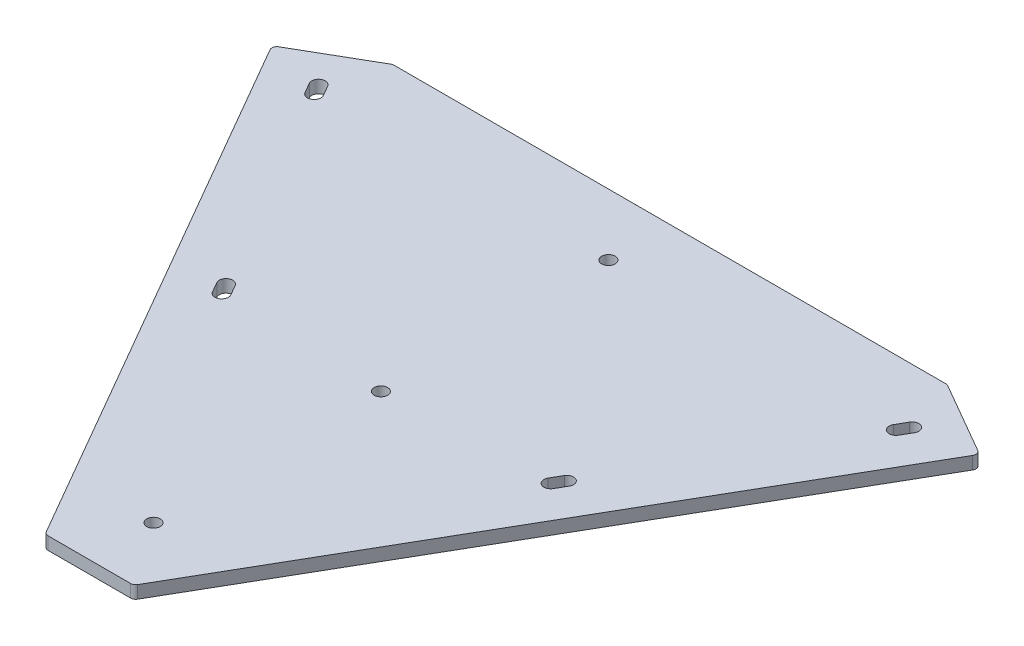
from build123d import *

# Parameters (mm, degrees)
BOSS_EXTRUDE1_DEPTH     = 6.35
F_1_4_CLEARANCE_HOLE1_D = 6.7564
CUT_EXTRUDE1_DEPTH      = 376.065853402
FILLET1_R               = 2.54


with BuildPart() as part:
    # Sketch1 → Boss-Extrude1 (new body)
    with BuildSketch(Plane(origin=(0, 0, 0), x_dir=(1, 0, 0), z_dir=(0, 1, 0))):
        Polygon((-177.8, 307.958633586), (-22.225, 38.494829198), (22.225, 38.494829198), (177.8, 307.958633586), (139.305170802, 330.183633586), (-139.305170802, 330.183633586), align=None)
    extrude(amount=BOSS_EXTRUDE1_DEPTH)

    # 1/4 Clearance Hole1 (through all)
    with Locations(Plane(origin=(0, 6.35, 0), x_dir=(1, 0, 0), z_dir=(0, 1, 0))):
        with Locations((0, 299.260881198), (0, 70.660881198), (0, 184.960881198)):
            Hole(F_1_4_CLEARANCE_HOLE1_D / 2)

    # Sketch6 → Cut-Extrude1 (cut, through all)
    with BuildSketch(Plane(origin=(0, 6.35, 0), x_dir=(1, 0, 0), z_dir=(0, 1, 0))):
        with BuildLine():
            Line((-146.190878382, 304.41642896), (-143.219078382, 299.269120371))
            ThreePointArc((-143.219078382, 299.269120371), (-144.455585401, 294.654413351), (-149.07029242, 295.890920371))
            Line((-149.07029242, 295.890920371), (-152.04209242, 301.03822896))
            ThreePointArc((-152.04209242, 301.03822896), (-150.805585401, 305.65293598), (-146.190878382, 304.41642896))
        make_face()
        with BuildLine():
            Line((-85.57029242, 185.90569409), (-88.54209242, 191.05300268))
            ThreePointArc((-88.54209242, 191.05300268), (-87.305585401, 195.667709699), (-82.690878382, 194.43120268))
            Line((-82.690878382, 194.43120268), (-79.719078382, 189.28389409))
            ThreePointArc((-79.719078382, 189.28389409), (-80.955585401, 184.669187071), (-85.57029242, 185.90569409))
        make_face()
        with BuildLine():
            Line((146.190878382, 304.41642896), (143.219078382, 299.269120371))
            ThreePointArc((143.219078382, 299.269120371), (144.455585401, 294.654413351), (149.07029242, 295.890920371))
            Line((149.07029242, 295.890920371), (152.04209242, 301.03822896))
            ThreePointArc((152.04209242, 301.03822896), (150.805585401, 305.65293598), (146.190878382, 304.41642896))
        make_face()
        with BuildLine():
            Line((85.57029242, 185.90569409), (88.54209242, 191.05300268))
            ThreePointArc((88.54209242, 191.05300268), (87.305585401, 195.667709699), (82.690878382, 194.43120268))
            Line((82.690878382, 194.43120268), (79.719078382, 189.28389409))
            ThreePointArc((79.719078382, 189.28389409), (80.955585401, 184.669187071), (85.57029242, 185.90569409))
        make_face()
    extrude(amount=-CUT_EXTRUDE1_DEPTH, mode=Mode.SUBTRACT)

    # Fillet1
    fillet1_edges = [part.edges().sort_by_distance(p)[0] for p in [
        (22.225, 3.175, -38.494829198),
        (-22.225, 3.175, -38.494829198),
        (-177.8, 3.175, -307.958633586),
        (-139.305170802, 3.175, -330.183633586),
        (139.305170802, 3.175, -330.183633586),
        (177.8, 3.175, -307.958633586),
    ]]
    fillet(fillet1_edges, radius=FILLET1_R)


solid = part.part
